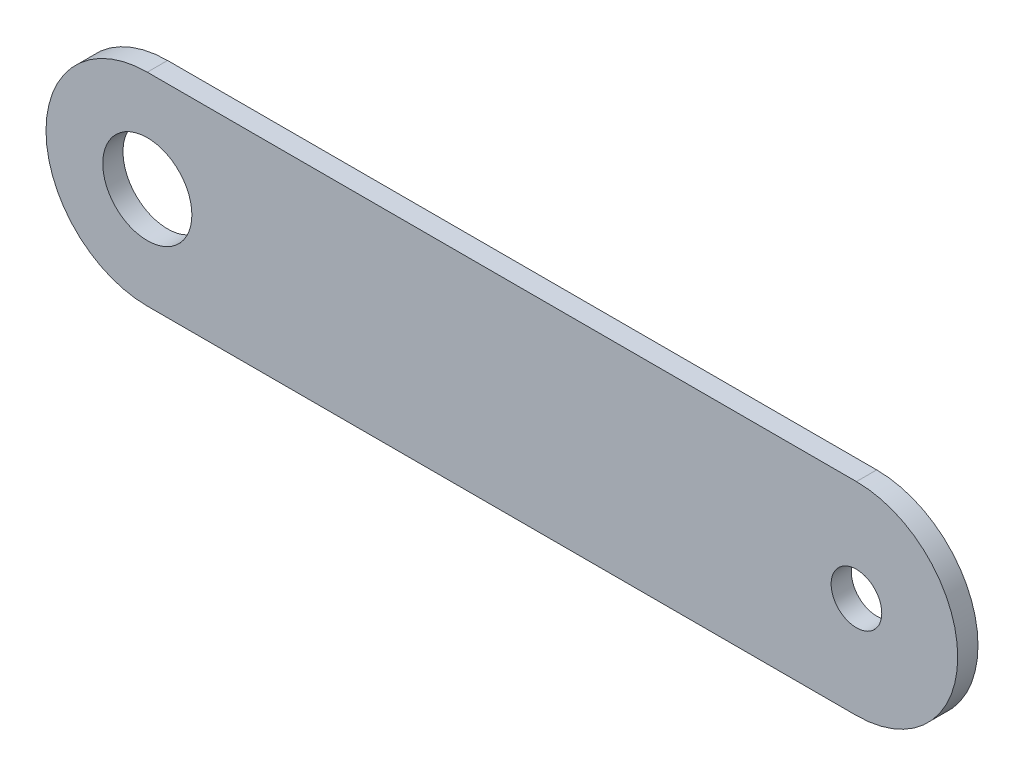
from build123d import *

# Parameters (mm, degrees)
SKETCH1_R           = 4.4
SKETCH1_R_2         = 2.5
BOSS_EXTRUDE1_DEPTH = 2


with BuildPart() as part:
    # Sketch1 → Boss-Extrude1 (new body)
    with BuildSketch(Plane.XY):
        with BuildLine():
            Line((-18.670886076, 10), (51.329113924, 10))
            ThreePointArc((51.329113924, 10), (61.329113924, 0), (51.329113924, -10))
            Line((51.329113924, -10), (-18.670886076, -10))
            ThreePointArc((-18.670886076, -10), (-28.670886076, 0), (-18.670886076, 10))
        make_face()
        with Locations((-18.670886076, 0)):
            Circle(SKETCH1_R, mode=Mode.SUBTRACT)
        with Locations((51.329113924, 0)):
            Circle(SKETCH1_R_2, mode=Mode.SUBTRACT)
    extrude(amount=BOSS_EXTRUDE1_DEPTH)


solid = part.part
